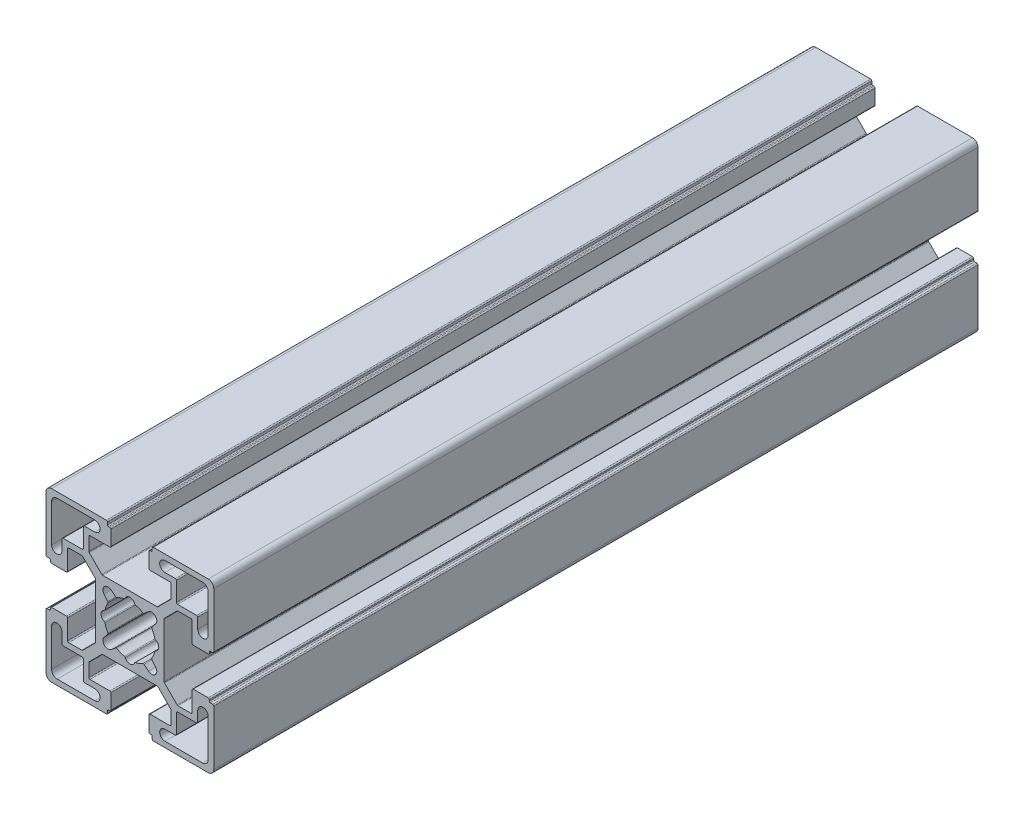
from build123d import *

# Parameters (mm, degrees)
RESSALTO_EXTRUS_O2_DEPTH = 205


with BuildPart() as part:
    # Sketch1 → Ressalto-extrusão2 (new body)
    with BuildSketch(Plane.XY):
        with BuildLine():
            Line((22.5, 6.3), (22.5, 21))
            ThreePointArc((22.5, 21), (22.060660172, 22.060660172), (21, 22.5))
            Line((21, 22.5), (6.3, 22.5))
            ThreePointArc((6.3, 22.5), (6.087867966, 22.412132034), (6, 22.2))
            Line((6, 22.2), (6, 21.6))
            ThreePointArc((6, 21.6), (5.912132034, 21.387867966), (5.7, 21.3))
            Line((5.7, 21.3), (5.4, 21.3))
            ThreePointArc((5.4, 21.3), (5.187867966, 21.212132034), (5.1, 21))
            Line((5.1, 21), (5.1, 17))
            ThreePointArc((5.1, 17), (5.187867966, 16.787867966), (5.4, 16.7))
            Line((5.4, 16.7), (10.7, 16.7))
            ThreePointArc((10.7, 16.7), (10.912132034, 16.612132034), (11, 16.4))
            Line((11, 16.4), (11, 12.892031022))
            ThreePointArc((11, 12.892031022), (10.97716386, 12.777225992), (10.912132034, 12.679898987))
            Line((10.912132034, 12.679898987), (7.520101013, 9.287867966))
            ThreePointArc((7.520101013, 9.287867966), (7.422774008, 9.22283614), (7.307968978, 9.2))
            Line((7.307968978, 9.2), (-7.307968978, 9.2))
            ThreePointArc((-7.307968978, 9.2), (-7.422774008, 9.22283614), (-7.520101013, 9.287867966))
            Line((-7.520101013, 9.287867966), (-10.912132034, 12.679898987))
            ThreePointArc((-10.912132034, 12.679898987), (-10.97716386, 12.777225992), (-11, 12.892031022))
            Line((-11, 12.892031022), (-11, 16.4))
            ThreePointArc((-11, 16.4), (-10.912132034, 16.612132034), (-10.7, 16.7))
            Line((-10.7, 16.7), (-5.4, 16.7))
            ThreePointArc((-5.4, 16.7), (-5.187867966, 16.787867966), (-5.1, 17))
            Line((-5.1, 17), (-5.1, 21))
            ThreePointArc((-5.1, 21), (-5.187867966, 21.212132034), (-5.4, 21.3))
            Line((-5.4, 21.3), (-5.7, 21.3))
            ThreePointArc((-5.7, 21.3), (-5.912132034, 21.387867966), (-6, 21.6))
            Line((-6, 21.6), (-6, 22.2))
            ThreePointArc((-6, 22.2), (-6.087867966, 22.412132034), (-6.3, 22.5))
            Line((-6.3, 22.5), (-21, 22.5))
            ThreePointArc((-21, 22.5), (-22.060660172, 22.060660172), (-22.5, 21))
            Line((-22.5, 21), (-22.5, 6.3))
            ThreePointArc((-22.5, 6.3), (-22.412132034, 6.087867966), (-22.2, 6))
            Line((-22.2, 6), (-21.6, 6))
            ThreePointArc((-21.6, 6), (-21.387867966, 5.912132034), (-21.3, 5.7))
            Line((-21.3, 5.7), (-21.3, 5.4))
            ThreePointArc((-21.3, 5.4), (-21.212132034, 5.187867966), (-21, 5.1))
            Line((-21, 5.1), (-17, 5.1))
            ThreePointArc((-17, 5.1), (-16.787867966, 5.187867966), (-16.7, 5.4))
            Line((-16.7, 5.4), (-16.7, 10.7))
            ThreePointArc((-16.7, 10.7), (-16.612132034, 10.912132034), (-16.4, 11))
            Line((-16.4, 11), (-12.892031022, 11))
            ThreePointArc((-12.892031022, 11), (-12.777225992, 10.97716386), (-12.679898987, 10.912132034))
            Line((-12.679898987, 10.912132034), (-9.287867966, 7.520101013))
            ThreePointArc((-9.287867966, 7.520101013), (-9.22283614, 7.422774008), (-9.2, 7.307968978))
            Line((-9.2, 7.307968978), (-9.2, -7.307968978))
            ThreePointArc((-9.2, -7.307968978), (-9.22283614, -7.422774008), (-9.287867966, -7.520101013))
            Line((-9.287867966, -7.520101013), (-12.679898987, -10.912132034))
            ThreePointArc((-12.679898987, -10.912132034), (-12.777225992, -10.97716386), (-12.892031022, -11))
            Line((-12.892031022, -11), (-16.4, -11))
            ThreePointArc((-16.4, -11), (-16.612132034, -10.912132034), (-16.7, -10.7))
            Line((-16.7, -10.7), (-16.7, -5.4))
            ThreePointArc((-16.7, -5.4), (-16.787867966, -5.187867966), (-17, -5.1))
            Line((-17, -5.1), (-21, -5.1))
            ThreePointArc((-21, -5.1), (-21.212132034, -5.187867966), (-21.3, -5.4))
            Line((-21.3, -5.4), (-21.3, -5.7))
            ThreePointArc((-21.3, -5.7), (-21.387867966, -5.912132034), (-21.6, -6))
            Line((-21.6, -6), (-22.2, -6))
            ThreePointArc((-22.2, -6), (-22.412132034, -6.087867966), (-22.5, -6.3))
            Line((-22.5, -6.3), (-22.5, -21))
            ThreePointArc((-22.5, -21), (-22.060660172, -22.060660172), (-21, -22.5))
            Line((-21, -22.5), (-6.3, -22.5))
            ThreePointArc((-6.3, -22.5), (-6.087867966, -22.412132034), (-6, -22.2))
            Line((-6, -22.2), (-6, -21.6))
            ThreePointArc((-6, -21.6), (-5.912132034, -21.387867966), (-5.7, -21.3))
            Line((-5.7, -21.3), (-5.4, -21.3))
            ThreePointArc((-5.4, -21.3), (-5.187867966, -21.212132034), (-5.1, -21))
            Line((-5.1, -21), (-5.1, -17))
            ThreePointArc((-5.1, -17), (-5.187867966, -16.787867966), (-5.4, -16.7))
            Line((-5.4, -16.7), (-10.7, -16.7))
            ThreePointArc((-10.7, -16.7), (-10.912132034, -16.612132034), (-11, -16.4))
            Line((-11, -16.4), (-11, -12.892031022))
            ThreePointArc((-11, -12.892031022), (-10.97716386, -12.777225992), (-10.912132034, -12.679898987))
            Line((-10.912132034, -12.679898987), (-7.432233047, -9.2))
            Line((-7.432233047, -9.2), (7.307968978, -9.2))
            ThreePointArc((7.307968978, -9.2), (7.422774008, -9.22283614), (7.520101013, -9.287867966))
            Line((7.520101013, -9.287867966), (10.912132034, -12.679898987))
            ThreePointArc((10.912132034, -12.679898987), (10.97716386, -12.777225992), (11, -12.892031022))
            Line((11, -12.892031022), (11, -16.4))
            ThreePointArc((11, -16.4), (10.912132034, -16.612132034), (10.7, -16.7))
            Line((10.7, -16.7), (5.4, -16.7))
            ThreePointArc((5.4, -16.7), (5.187867966, -16.787867966), (5.1, -17))
            Line((5.1, -17), (5.1, -21))
            ThreePointArc((5.1, -21), (5.187867966, -21.212132034), (5.4, -21.3))
            Line((5.4, -21.3), (5.7, -21.3))
            ThreePointArc((5.7, -21.3), (5.912132034, -21.387867966), (6, -21.6))
            Line((6, -21.6), (6, -22.2))
            ThreePointArc((6, -22.2), (6.087867966, -22.412132034), (6.3, -22.5))
            Line((6.3, -22.5), (21, -22.5))
            ThreePointArc((21, -22.5), (22.060660172, -22.060660172), (22.5, -21))
            Line((22.5, -21), (22.5, -6.3))
            ThreePointArc((22.5, -6.3), (22.412132034, -6.087867966), (22.2, -6))
            Line((22.2, -6), (21.6, -6))
            ThreePointArc((21.6, -6), (21.387867966, -5.912132034), (21.3, -5.7))
            Line((21.3, -5.7), (21.3, -5.4))
            ThreePointArc((21.3, -5.4), (21.212132034, -5.187867966), (21, -5.1))
            Line((21, -5.1), (17, -5.1))
            ThreePointArc((17, -5.1), (16.787867966, -5.187867966), (16.7, -5.4))
            Line((16.7, -5.4), (16.7, -10.7))
            ThreePointArc((16.7, -10.7), (16.612132034, -10.912132034), (16.4, -11))
            Line((16.4, -11), (12.892031022, -11))
            ThreePointArc((12.892031022, -11), (12.777225992, -10.97716386), (12.679898987, -10.912132034))
            Line((12.679898987, -10.912132034), (9.287867966, -7.520101013))
            ThreePointArc((9.287867966, -7.520101013), (9.22283614, -7.422774008), (9.2, -7.307968978))
            Line((9.2, -7.307968978), (9.2, 7.307968978))
            ThreePointArc((9.2, 7.307968978), (9.22283614, 7.422774008), (9.287867966, 7.520101013))
            Line((9.287867966, 7.520101013), (12.679898987, 10.912132034))
            ThreePointArc((12.679898987, 10.912132034), (12.777225992, 10.97716386), (12.892031022, 11))
            Line((12.892031022, 11), (16.4, 11))
            ThreePointArc((16.4, 11), (16.612132034, 10.912132034), (16.7, 10.7))
            Line((16.7, 10.7), (16.7, 5.4))
            ThreePointArc((16.7, 5.4), (16.787867966, 5.187867966), (17, 5.1))
            Line((17, 5.1), (21, 5.1))
            ThreePointArc((21, 5.1), (21.212132034, 5.187867966), (21.3, 5.4))
            Line((21.3, 5.4), (21.3, 5.7))
            ThreePointArc((21.3, 5.7), (21.387867966, 5.912132034), (21.6, 6))
            Line((21.6, 6), (22.2, 6))
            ThreePointArc((22.2, 6), (22.412132034, 6.087867966), (22.5, 6.3))
        make_face()
        with BuildLine():
            Line((-3.818215474, 5.929763323), (-5.011190062, 6.911428437))
            ThreePointArc((-5.011190062, 6.911428437), (-6.823580438, 6.823580438), (-6.911428437, 5.011190062))
            Line((-6.911428437, 5.011190062), (-5.929763323, 3.818215474))
            ThreePointArc((-5.929763323, 3.818215474), (-5.862334174, 3.651033002), (-5.902896136, 3.475387346))
            ThreePointArc((-5.902896136, 3.475387346), (-6.374221536, 2.50834603), (-6.68833042, 1.479437798))
            ThreePointArc((-6.68833042, 1.479437798), (-6.754573553, 1.347716602), (-6.875568182, 1.263461477))
            ThreePointArc((-6.875568182, 1.263461477), (-7.75, 0), (-6.875568182, -1.263461477))
            ThreePointArc((-6.875568182, -1.263461477), (-6.754573553, -1.347716602), (-6.68833042, -1.479437798))
            ThreePointArc((-6.68833042, -1.479437798), (-6.374221536, -2.50834603), (-5.902896136, -3.475387346))
            ThreePointArc((-5.902896136, -3.475387346), (-5.862334174, -3.651033002), (-5.929763323, -3.818215474))
            Line((-5.929763323, -3.818215474), (-6.911428437, -5.011190062))
            ThreePointArc((-6.911428437, -5.011190062), (-6.823580438, -6.823580438), (-5.011190062, -6.911428437))
            Line((-5.011190062, -6.911428437), (-3.818215474, -5.929763323))
            ThreePointArc((-3.818215474, -5.929763323), (-3.651033002, -5.862334174), (-3.475387346, -5.902896136))
            ThreePointArc((-3.475387346, -5.902896136), (-2.50834603, -6.374221536), (-1.479437798, -6.68833042))
            ThreePointArc((-1.479437798, -6.68833042), (-1.347716602, -6.754573553), (-1.263461477, -6.875568182))
            ThreePointArc((-1.263461477, -6.875568182), (0, -7.75), (1.263461477, -6.875568182))
            ThreePointArc((1.263461477, -6.875568182), (1.347716602, -6.754573553), (1.479437798, -6.68833042))
            ThreePointArc((1.479437798, -6.68833042), (2.50834603, -6.374221536), (3.475387346, -5.902896136))
            ThreePointArc((3.475387346, -5.902896136), (3.651033002, -5.862334174), (3.818215474, -5.929763323))
            Line((3.818215474, -5.929763323), (5.011190062, -6.911428437))
            ThreePointArc((5.011190062, -6.911428437), (6.823580438, -6.823580438), (6.911428437, -5.011190062))
            Line((6.911428437, -5.011190062), (5.929763323, -3.818215474))
            ThreePointArc((5.929763323, -3.818215474), (5.862334174, -3.651033002), (5.902896136, -3.475387346))
            ThreePointArc((5.902896136, -3.475387346), (6.374221536, -2.50834603), (6.68833042, -1.479437798))
            ThreePointArc((6.68833042, -1.479437798), (6.754573553, -1.347716602), (6.875568182, -1.263461477))
            ThreePointArc((6.875568182, -1.263461477), (7.75, 0), (6.875568182, 1.263461477))
            ThreePointArc((6.875568182, 1.263461477), (6.754573553, 1.347716602), (6.68833042, 1.479437798))
            ThreePointArc((6.68833042, 1.479437798), (6.374221536, 2.50834603), (5.902896136, 3.475387346))
            ThreePointArc((5.902896136, 3.475387346), (5.862334174, 3.651033002), (5.929763323, 3.818215474))
            Line((5.929763323, 3.818215474), (6.911428437, 5.011190062))
            ThreePointArc((6.911428437, 5.011190062), (6.823580438, 6.823580438), (5.011190062, 6.911428437))
            Line((5.011190062, 6.911428437), (3.818215474, 5.929763323))
            ThreePointArc((3.818215474, 5.929763323), (3.651033002, 5.862334174), (3.475387346, 5.902896136))
            ThreePointArc((3.475387346, 5.902896136), (2.50834603, 6.374221536), (1.479437798, 6.68833042))
            ThreePointArc((1.479437798, 6.68833042), (1.347716602, 6.754573553), (1.263461477, 6.875568182))
            ThreePointArc((1.263461477, 6.875568182), (0, 7.75), (-1.263461477, 6.875568182))
            ThreePointArc((-1.263461477, 6.875568182), (-1.347716602, 6.754573553), (-1.479437798, 6.68833042))
            ThreePointArc((-1.479437798, 6.68833042), (-2.50834603, 6.374221536), (-3.475387346, 5.902896136))
            ThreePointArc((-3.475387346, 5.902896136), (-3.651033002, 5.862334174), (-3.818215474, 5.929763323))
        make_face(mode=Mode.SUBTRACT)
        with BuildLine():
            Line((-19.5, -21), (-9.4, -21))
            ThreePointArc((-9.4, -21), (-8, -19.6), (-9.4, -18.2))
            Line((-9.4, -18.2), (-12.2, -18.2))
            ThreePointArc((-12.2, -18.2), (-12.412132034, -18.112132034), (-12.5, -17.9))
            Line((-12.5, -17.9), (-12.5, -12.8))
            ThreePointArc((-12.5, -12.8), (-12.587867966, -12.587867966), (-12.8, -12.5))
            Line((-12.8, -12.5), (-17.9, -12.5))
            ThreePointArc((-17.9, -12.5), (-18.112132034, -12.412132034), (-18.2, -12.2))
            Line((-18.2, -12.2), (-18.2, -9.4))
            ThreePointArc((-18.2, -9.4), (-19.6, -8), (-21, -9.4))
            Line((-21, -9.4), (-21, -19.5))
            ThreePointArc((-21, -19.5), (-20.560660172, -20.560660172), (-19.5, -21))
        make_face(mode=Mode.SUBTRACT)
        with BuildLine():
            Line((17.9, -12.5), (12.8, -12.5))
            ThreePointArc((12.8, -12.5), (12.587867966, -12.587867966), (12.5, -12.8))
            Line((12.5, -12.8), (12.5, -17.9))
            ThreePointArc((12.5, -17.9), (12.412132034, -18.112132034), (12.2, -18.2))
            Line((12.2, -18.2), (9.4, -18.2))
            ThreePointArc((9.4, -18.2), (8, -19.6), (9.4, -21))
            Line((9.4, -21), (19.5, -21))
            ThreePointArc((19.5, -21), (20.560660172, -20.560660172), (21, -19.5))
            Line((21, -19.5), (21, -9.4))
            ThreePointArc((21, -9.4), (19.6, -8), (18.2, -9.4))
            Line((18.2, -9.4), (18.2, -12.2))
            ThreePointArc((18.2, -12.2), (18.112132034, -12.412132034), (17.9, -12.5))
        make_face(mode=Mode.SUBTRACT)
        with BuildLine():
            Line((19.5, 21), (9.4, 21))
            ThreePointArc((9.4, 21), (8, 19.6), (9.4, 18.2))
            Line((9.4, 18.2), (12.2, 18.2))
            ThreePointArc((12.2, 18.2), (12.412132034, 18.112132034), (12.5, 17.9))
            Line((12.5, 17.9), (12.5, 12.8))
            ThreePointArc((12.5, 12.8), (12.587867966, 12.587867966), (12.8, 12.5))
            Line((12.8, 12.5), (17.9, 12.5))
            ThreePointArc((17.9, 12.5), (18.112132034, 12.412132034), (18.2, 12.2))
            Line((18.2, 12.2), (18.2, 9.4))
            ThreePointArc((18.2, 9.4), (19.6, 8), (21, 9.4))
            Line((21, 9.4), (21, 19.5))
            ThreePointArc((21, 19.5), (20.560660172, 20.560660172), (19.5, 21))
        make_face(mode=Mode.SUBTRACT)
        with BuildLine():
            Line((-18.2, 9.4), (-18.2, 12.2))
            ThreePointArc((-18.2, 12.2), (-18.112132034, 12.412132034), (-17.9, 12.5))
            Line((-17.9, 12.5), (-12.8, 12.5))
            ThreePointArc((-12.8, 12.5), (-12.587867966, 12.587867966), (-12.5, 12.8))
            Line((-12.5, 12.8), (-12.5, 17.9))
            ThreePointArc((-12.5, 17.9), (-12.412132034, 18.112132034), (-12.2, 18.2))
            Line((-12.2, 18.2), (-9.4, 18.2))
            ThreePointArc((-9.4, 18.2), (-8, 19.6), (-9.4, 21))
            Line((-9.4, 21), (-19.5, 21))
            ThreePointArc((-19.5, 21), (-20.560660172, 20.560660172), (-21, 19.5))
            Line((-21, 19.5), (-21, 9.4))
            ThreePointArc((-21, 9.4), (-19.6, 8), (-18.2, 9.4))
        make_face(mode=Mode.SUBTRACT)
    extrude(amount=RESSALTO_EXTRUS_O2_DEPTH)


solid = part.part
